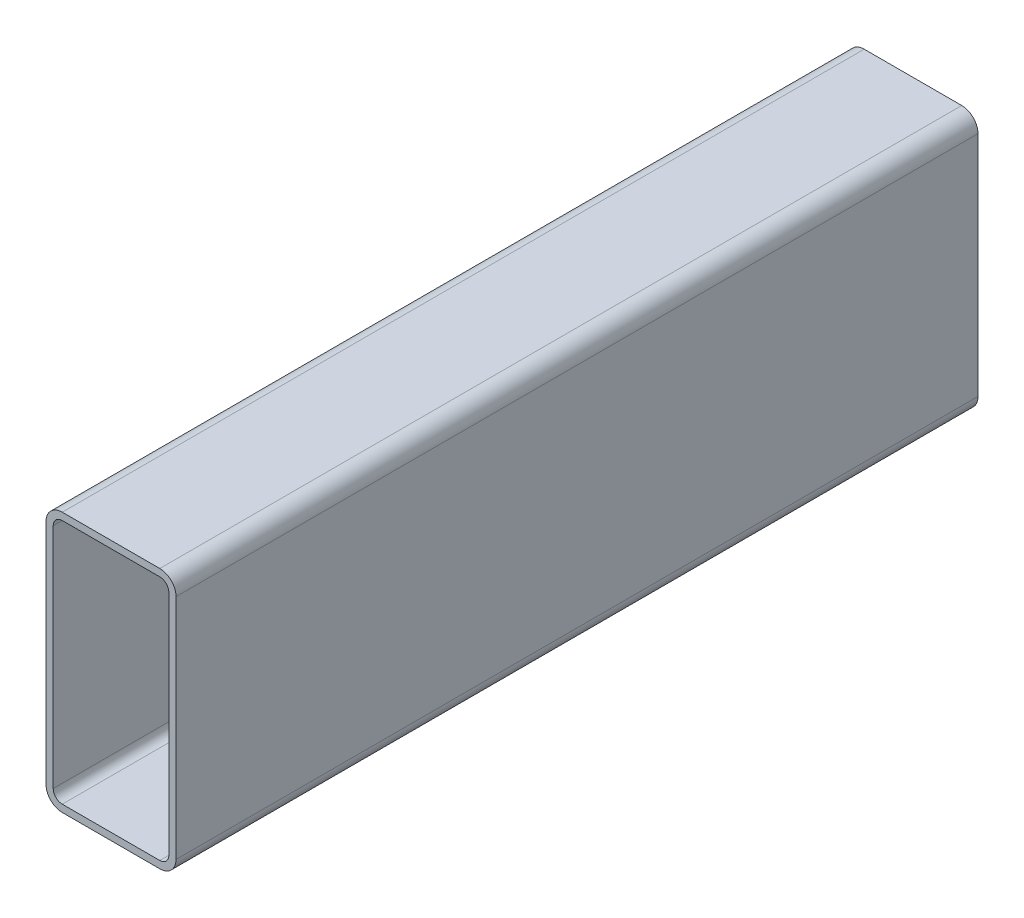
from build123d import *

# Parameters (mm, degrees)
STRUCTURAL_MEMBER1_DEPTH = 234.95


with BuildPart() as part:
    # Sketch13 → Structural Member1 (new body)
    with BuildSketch(Plane.XY):
        with BuildLine():
            Line((-14.2875, -38.1), (14.2875, -38.1))
            ThreePointArc((14.2875, -38.1), (17.655096045, -36.705096045), (19.05, -33.3375))
            Line((19.05, -33.3375), (19.05, 33.3375))
            ThreePointArc((19.05, 33.3375), (17.655096045, 36.705096045), (14.2875, 38.1))
            Line((14.2875, 38.1), (-14.2875, 38.1))
            ThreePointArc((-14.2875, 38.1), (-17.655096045, 36.705096045), (-19.05, 33.3375))
            Line((-19.05, 33.3375), (-19.05, -33.3375))
            ThreePointArc((-19.05, -33.3375), (-17.655096045, -36.705096045), (-14.2875, -38.1))
        make_face()
        with BuildLine():
            Line((-14.2875, -35.98418), (14.2875, -35.98418))
            ThreePointArc((14.2875, -35.98418), (16.158985376, -35.208985376), (16.93418, -33.3375))
            Line((16.93418, -33.3375), (16.93418, 33.3375))
            ThreePointArc((16.93418, 33.3375), (16.158985376, 35.208985376), (14.2875, 35.98418))
            Line((14.2875, 35.98418), (-14.2875, 35.98418))
            ThreePointArc((-14.2875, 35.98418), (-16.158985376, 35.208985376), (-16.93418, 33.3375))
            Line((-16.93418, 33.3375), (-16.93418, -33.3375))
            ThreePointArc((-16.93418, -33.3375), (-16.158985376, -35.208985376), (-14.2875, -35.98418))
        make_face(mode=Mode.SUBTRACT)
    extrude(amount=STRUCTURAL_MEMBER1_DEPTH)


solid = part.part
